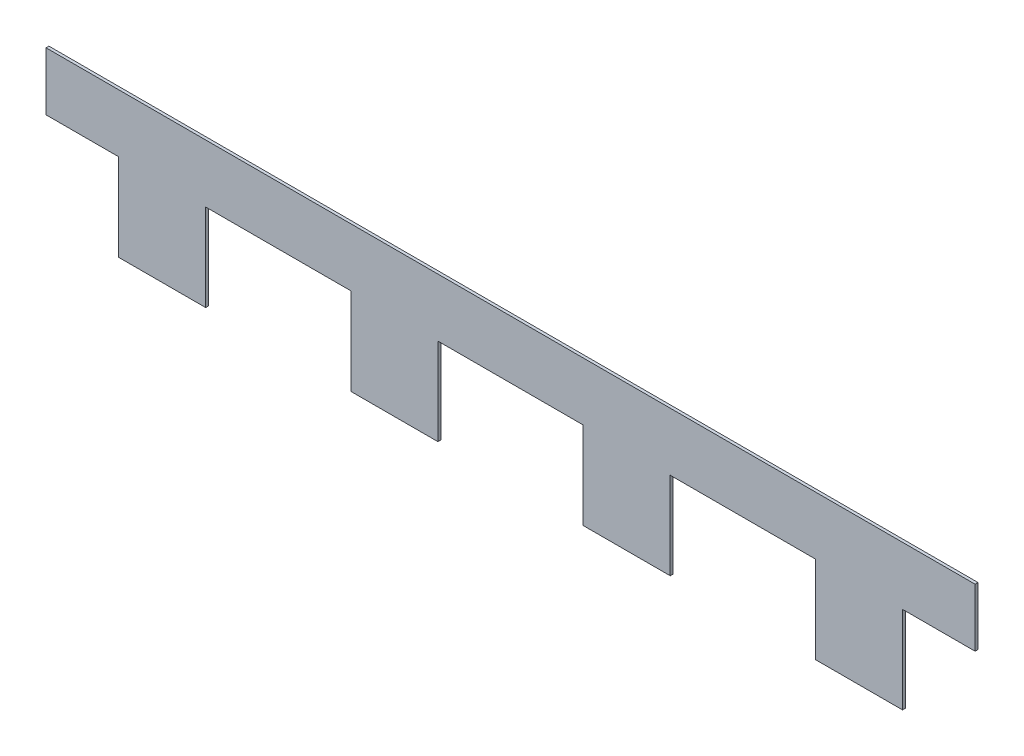
from build123d import *

# Parameters (mm, degrees)
BOSS_EXTRUDE1_DEPTH = 0.1


with BuildPart() as part:
    # Sketch1 → Boss-Extrude1 (new body)
    with BuildSketch(Plane.XY):
        Polygon((6.5, -4), (9.5, -4), (9.5, -1), (14.5, -1), (14.5, -4), (17.5, -4), (17.5, -1), (22.5, -1), (22.5, -4), (25.5, -4), (25.5, -1), (28, -1), (28, 1), (-4, 1), (-4, -1), (-1.5, -1), (-1.5, -4), (1.5, -4), (1.5, -1), (6.5, -1), align=None)
    extrude(amount=BOSS_EXTRUDE1_DEPTH)


solid = part.part
